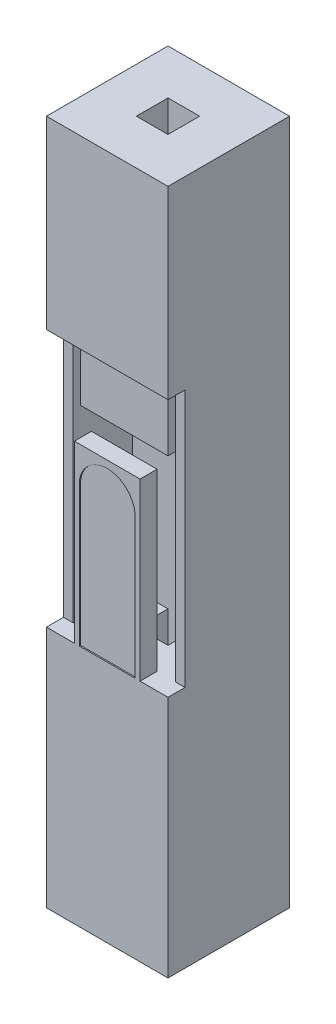
from build123d import *

# Parameters (mm, degrees)
SKETCH2_W           = 2.5
SKETCH2_H           = 2.5
BOSS_EXTRUDE1_DEPTH = 7.05
PINHOLE_REACH       = 16.21
SKETCH3_W           = 0.65
SKETCH3_H           = 0.65
CUT_EXTRUDE2_DEPTH  = 0.35
SKETCH5_W           = 2.1
SKETCH5_H           = 5.3
CUT_EXTRUDE3_DEPTH  = 1.225
CUT_EXTRUDE5_DEPTH  = 0.025
SKETCH7_W           = 2.1
SKETCH7_H           = 2.1
CUT_EXTRUDE6_DEPTH  = 4
SKETCH9_W           = 0.15
SKETCH9_H           = 1
HOLDER_1_DEPTH      = 1.075
SKETCH10_W          = 1.8
SKETCH10_H          = 1
HOLDER_2_DEPTH      = 0.15


with BuildPart() as part:
    # Sketch2 → Boss-Extrude1 (new, symmetric)
    with BuildSketch(Plane(origin=(0, 0, 0), x_dir=(1, 0, 0), z_dir=(0, 1, 0))):
        Rectangle(SKETCH2_W, SKETCH2_H)
    extrude(amount=BOSS_EXTRUDE1_DEPTH, both=True)

    # Sketch3 → Pinhole (cut, up to next)
    with BuildSketch(Plane(origin=(0, 7.05, 0), x_dir=(1, 0, 0), z_dir=(0, 1, 0)), mode=Mode.PRIVATE) as pinhole_sk1:
        Rectangle(SKETCH3_W, SKETCH3_H)
    pinhole_tool1 = extrude(pinhole_sk1.sketch, amount=-PINHOLE_REACH, mode=Mode.PRIVATE) & part.part
    add(pinhole_tool1.solids().sort_by_distance((0, 7.05, 0))[0], mode=Mode.SUBTRACT)

    # Sketch4 → Cut-Extrude2 (cut)
    with BuildSketch(Plane.XY.offset(1.25)):
        Polygon((-1.25, 3.25), (1.25, 3.25), (1.25, -2.05), (0.675, -2.05), (0.675, 1.55), (-0.675, 1.55), (-0.675, -2.05), (-1.25, -2.05), align=None)
    extrude(amount=-CUT_EXTRUDE2_DEPTH, mode=Mode.SUBTRACT)

    # Sketch5 → Cut-Extrude3 (cut)
    with BuildSketch(Plane.XY.offset(0.9)):
        with Locations((0, 0.6)):
            Rectangle(SKETCH5_W, SKETCH5_H)
    extrude(amount=-CUT_EXTRUDE3_DEPTH, mode=Mode.SUBTRACT)

    # Sketch6 → Cut-Extrude5 (cut)
    with BuildSketch(Plane.XY.offset(1.25)):
        with BuildLine():
            Line((-0.575, 0.825), (-0.575, -2.05))
            Line((-0.575, -2.05), (0, -2.05))
            Line((0, -2.05), (0, 1.4))
            ThreePointArc((0, 1.4), (-0.406586399, 1.231586399), (-0.575, 0.825))
        make_face()
        with BuildLine():
            Line((0, 1.4), (0, -2.05))
            Line((0, -2.05), (0.575, -2.05))
            Line((0.575, -2.05), (0.575, 0.825))
            ThreePointArc((0.575, 0.825), (0.406586399, 1.231586399), (0, 1.4))
        make_face()
    extrude(amount=-CUT_EXTRUDE5_DEPTH, mode=Mode.SUBTRACT)

    # Sketch7 → Cut-Extrude6 (cut)
    with BuildSketch(Plane.XZ.offset(7.05)):
        Rectangle(SKETCH7_W, SKETCH7_H)
    extrude(amount=-CUT_EXTRUDE6_DEPTH, mode=Mode.SUBTRACT)

    # Sketch9 → Holder-1 (add)
    with BuildSketch(Plane.XY.offset(-0.325)):
        with Locations((-0.825, 2.4)):
            Rectangle(SKETCH9_W, SKETCH9_H)
        with Locations((0.825, 2.4)):
            Rectangle(SKETCH9_W, SKETCH9_H)
    extrude(amount=HOLDER_1_DEPTH)

    # Sketch10 → Holder-2 (add)
    with BuildSketch(Plane.XY.offset(0.75)):
        with Locations((0, 2.4)):
            Rectangle(SKETCH10_W, SKETCH10_H)
    extrude(amount=HOLDER_2_DEPTH)


solid = part.part
